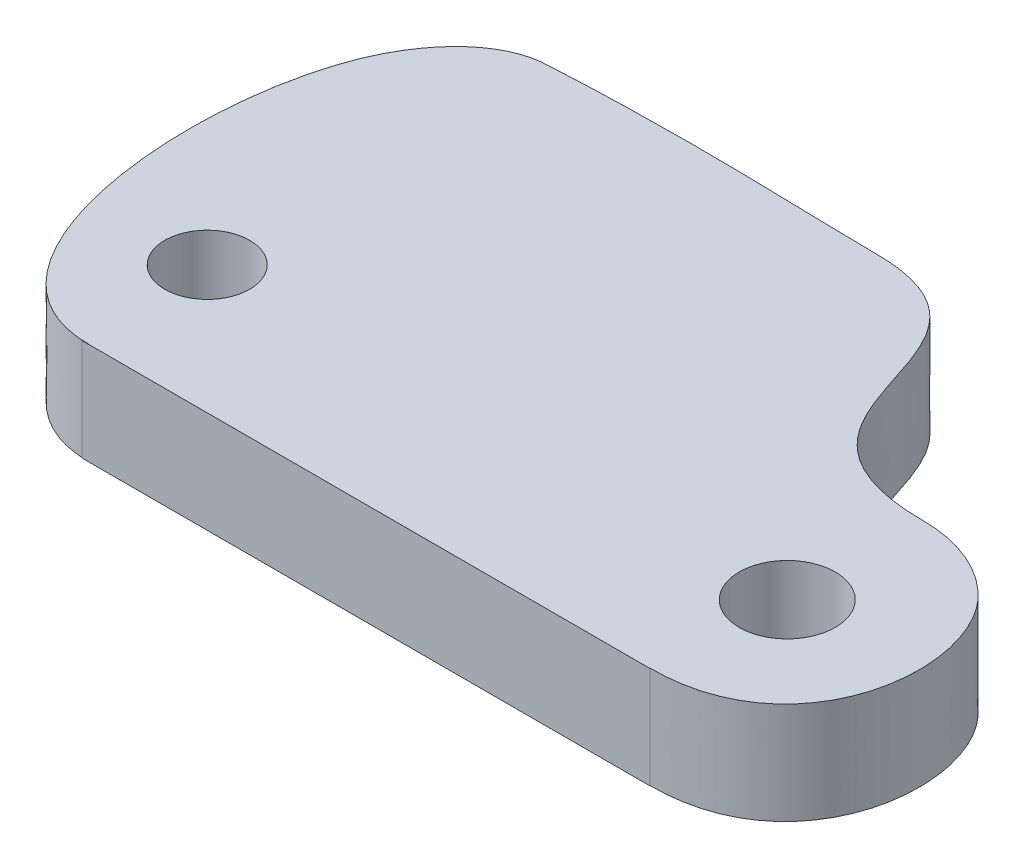
from build123d import *

# Parameters (mm, degrees)
SKETCH1_R           = 1.3251
SKETCH1_R_2         = 1.5002
BOSS_EXTRUDE1_DEPTH = 3.175


with BuildPart() as part:
    # Sketch1 → Boss-Extrude1 (new body)
    with BuildSketch(Plane(origin=(0, 0, 0), x_dir=(1, 0, 0), z_dir=(0, 1, 0))):
        with BuildLine():
            Line((24.252360584, 153.047337226), (24.066660584, 153.037137226))
            Line((24.066660584, 153.037137226), (41.780860584, 153.037137226))
            Line((41.780860584, 153.037137226), (41.780860584, 153.047237226))
            add(Edge.make_bspline(
                [(41.780860584, 153.047237226), (46.472460584, 153.023637226), (46.937960584, 158.355437226), (44.801360584, 160.253637226)],
                knots=[0.3, 0.3, 0.3, 0.3, 0.4, 0.4, 0.4, 0.4], degree=3))
            add(Edge.make_bspline(
                [(44.801360584, 160.253637226), (44.076060584, 160.918437226), (43.092260584, 161.292037226), (42.066560584, 161.292037226)],
                knots=[0.4, 0.4, 0.4, 0.4, 0.5, 0.5, 0.5, 0.5], degree=3))
            add(Edge.make_bspline(
                [(42.066560584, 161.292037226), (35.872760584, 161.305437226), (39.575560584, 167.746037226), (34.122660584, 167.769037226)],
                knots=[0.5, 0.5, 0.5, 0.5, 0.6, 0.6, 0.6, 0.6], degree=3))
            add(Edge.make_bspline(
                [(34.122660584, 167.769037226), (31.657460584, 167.779437226), (28.361660584, 167.993537226), (23.966660584, 167.746037226)],
                knots=[0.6, 0.6, 0.6, 0.6, 0.7, 0.7, 0.7, 0.7], degree=3))
            add(Edge.make_bspline(
                [(23.966660584, 167.746037226), (22.940960584, 167.746037226), (21.957160584, 167.079937226), (21.231860584, 165.894837226)],
                knots=[0.7, 0.7, 0.7, 0.7, 0.8, 0.8, 0.8, 0.8], degree=3))
            add(Edge.make_bspline(
                [(21.231860584, 165.894837226), (19.095260584, 162.510837226), (19.560760584, 153.005437226), (24.252360584, 153.047337226)],
                knots=[0.8, 0.8, 0.8, 0.8, 1, 1, 1, 1], degree=3))
        make_face()
        with Locations(Location((23.966660584, 157.037137226, 0), (0, 0, 270))):
            Circle(SKETCH1_R, mode=Mode.SUBTRACT)
        with Locations(Location((42.066460584, 157.037137226, 0), (0, 0, 270))):
            Circle(SKETCH1_R_2, mode=Mode.SUBTRACT)
    extrude(amount=BOSS_EXTRUDE1_DEPTH)


solid = part.part
